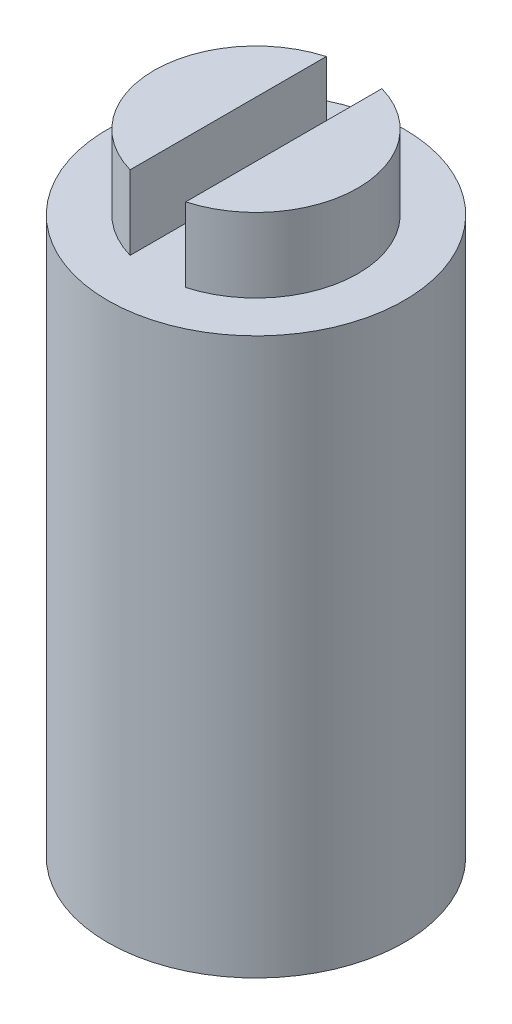
from build123d import *

# Parameters (mm, degrees)
SKETCH2_R           = 4
BOSS_EXTRUDE1_DEPTH = 15
BOSS_EXTRUDE2_DEPTH = 2


with BuildPart() as part:
    # Sketch2 → Boss-Extrude1 (new body)
    with BuildSketch(Plane(origin=(0, 0, 0), x_dir=(1, 0, 0), z_dir=(0, 1, 0))):
        with Locations(Location((0, 0, 0), (0, 0, 270))):
            Circle(SKETCH2_R)
    extrude(amount=-BOSS_EXTRUDE1_DEPTH)

    # Sketch3 → Boss-Extrude2 (add)
    with BuildSketch(Plane(origin=(0, 0, 0), x_dir=(1, 0, 0), z_dir=(0, 1, 0))):
        with BuildLine():
            Line((-0.75, 2.645751311), (-0.75, -2.645751311))
            ThreePointArc((-0.75, -2.645751311), (-2.75, 0), (-0.75, 2.645751311))
        make_face()
        with BuildLine():
            Line((0.75, 2.645751311), (0.75, -2.645751311))
            ThreePointArc((0.75, -2.645751311), (2.75, 0), (0.75, 2.645751311))
        make_face()
    extrude(amount=BOSS_EXTRUDE2_DEPTH)


solid = part.part
